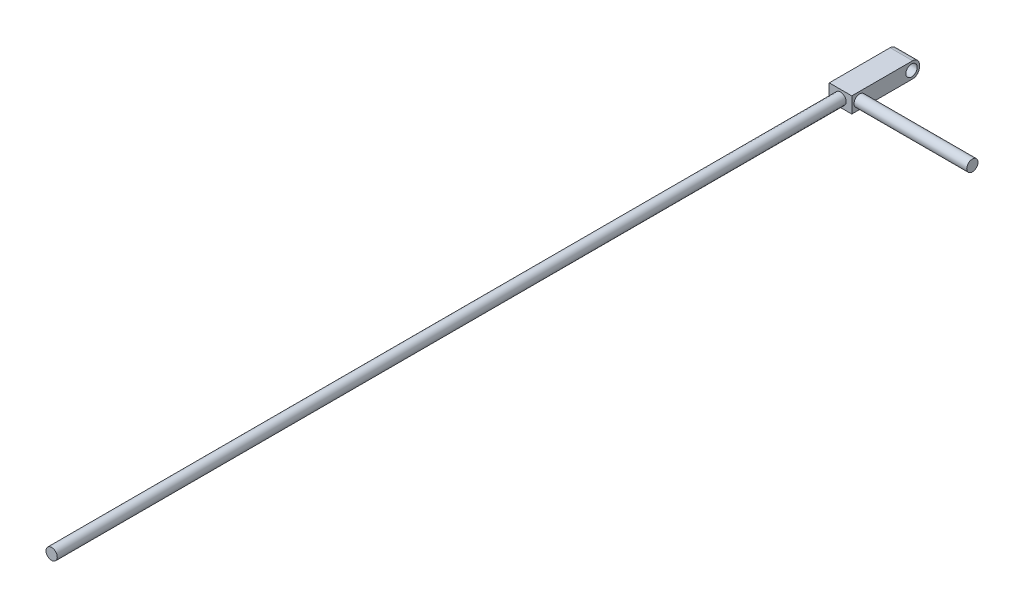
from build123d import *

# Parameters (mm, degrees)
SKETCH1_W           = 10
SKETCH1_H           = 7
BOSS_EXTRUDE1_DEPTH = 30
SKETCH2_R           = 2.5
CUT_EXTRUDE2_DEPTH  = 20
SKETCH2_3_R         = 2.5
BOSS_EXTRUDE2_DEPTH = 50
FILLET1_R           = 3
SKETCH3_R           = 2.5
BOSS_EXTRUDE3_DEPTH = 350


with BuildPart() as part:
    # Sketch1 → Boss-Extrude1 (new body)
    with BuildSketch(Plane.XY):
        Rectangle(SKETCH1_W, SKETCH1_H)
    extrude(amount=BOSS_EXTRUDE1_DEPTH)

    # Sketch2 → Cut-Extrude2 (cut)
    with BuildSketch(Plane(origin=(5, 0, 0), x_dir=(0, 0, -1), z_dir=(1, 0, 0))):
        with Locations((-3.5, 0)):
            Circle(SKETCH2_R)
    extrude(amount=-CUT_EXTRUDE2_DEPTH, mode=Mode.SUBTRACT)

    # Sketch2<3> → Boss-Extrude2 (add)
    with BuildSketch(Plane(origin=(5, 0, 0), x_dir=(0, 0, -1), z_dir=(1, 0, 0))):
        with Locations((-26.5, 0)):
            Circle(SKETCH2_3_R)
    extrude(amount=BOSS_EXTRUDE2_DEPTH)

    # Fillet1
    fillet1_edges = [part.edges().sort_by_distance(p)[0] for p in [
        (0, -3.5, 0),
        (0, 3.5, 0),
    ]]
    fillet(fillet1_edges, radius=FILLET1_R)

    # Sketch3 → Boss-Extrude3 (add)
    with BuildSketch(Plane.XY.offset(30)):
        Circle(SKETCH3_R)
    extrude(amount=BOSS_EXTRUDE3_DEPTH)


solid = part.part
